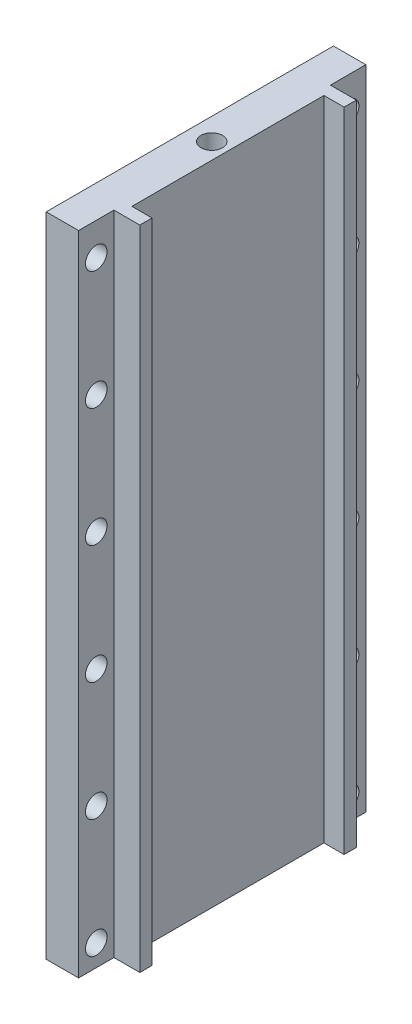
from build123d import *

# Parameters (mm, degrees)
BOSS_EXTRUDE1_DEPTH = 300
SKETCH3_R           = 5
CUT_EXTRUDE1_DEPTH  = 329.551266015
SKETCH5_R           = 5
CUT_EXTRUDE2_DEPTH  = 10
SKETCH7_R           = 5
CUT_EXTRUDE5_DEPTH  = 10


with BuildPart() as part:
    # Sketch2 → Boss-Extrude1 (new body)
    with BuildSketch(Plane(origin=(0, 0, 0), x_dir=(1, 0, 0), z_dir=(0, 1, 0))):
        Polygon((0, 0), (0, 133.12), (15, 133.12), (15, 116.725), (27, 116.725), (27, 111.06), (17.665, 111.06), (17.665, 22.06), (27, 22.06), (27, 16.395), (15, 16.395), (15, 0), align=None)
    extrude(amount=BOSS_EXTRUDE1_DEPTH)

    # Sketch3 → Cut-Extrude1 (cut, through all)
    with BuildSketch(Plane(origin=(15, 0, 0), x_dir=(0, 0, -1), z_dir=(1, 0, 0))):
        with Locations((8.1975, 285)):
            Circle(SKETCH3_R)
        with Locations((8.1975, 230)):
            Circle(SKETCH3_R)
        with Locations((8.1975, 175)):
            Circle(SKETCH3_R)
        with Locations((8.1975, 120)):
            Circle(SKETCH3_R)
        with Locations((8.1975, 65)):
            Circle(SKETCH3_R)
        with Locations((8.1975, 10)):
            Circle(SKETCH3_R)
        with Locations(Location((124.9225, 10, 0), (0, 0, 180))):
            Circle(SKETCH3_R)
        with Locations(Location((124.9225, 65, 0), (0, 0, 180))):
            Circle(SKETCH3_R)
        with Locations(Location((124.9225, 120, 0), (0, 0, 180))):
            Circle(SKETCH3_R)
        with Locations(Location((124.9225, 175, 0), (0, 0, 180))):
            Circle(SKETCH3_R)
        with Locations(Location((124.9225, 230, 0), (0, 0, 180))):
            Circle(SKETCH3_R)
        with Locations(Location((124.9225, 285, 0), (0, 0, 180))):
            Circle(SKETCH3_R)
    extrude(amount=-CUT_EXTRUDE1_DEPTH, mode=Mode.SUBTRACT)

    # Sketch5 → Cut-Extrude2 (cut)
    with BuildSketch(Plane(origin=(0, 300, 0), x_dir=(1, 0, 0), z_dir=(0, 1, 0))):
        with Locations(Location((10.165, 66.563164806, 0), (0, 0, 270))):
            Circle(SKETCH5_R)
    extrude(amount=-CUT_EXTRUDE2_DEPTH, mode=Mode.SUBTRACT)

    # Sketch7 → Cut-Extrude5 (cut)
    with BuildSketch(Plane.XZ):
        with Locations(Location((10.165, -66.56, 0), (0, 0, 270))):
            Circle(SKETCH7_R)
    extrude(amount=-CUT_EXTRUDE5_DEPTH, mode=Mode.SUBTRACT)


solid = part.part
